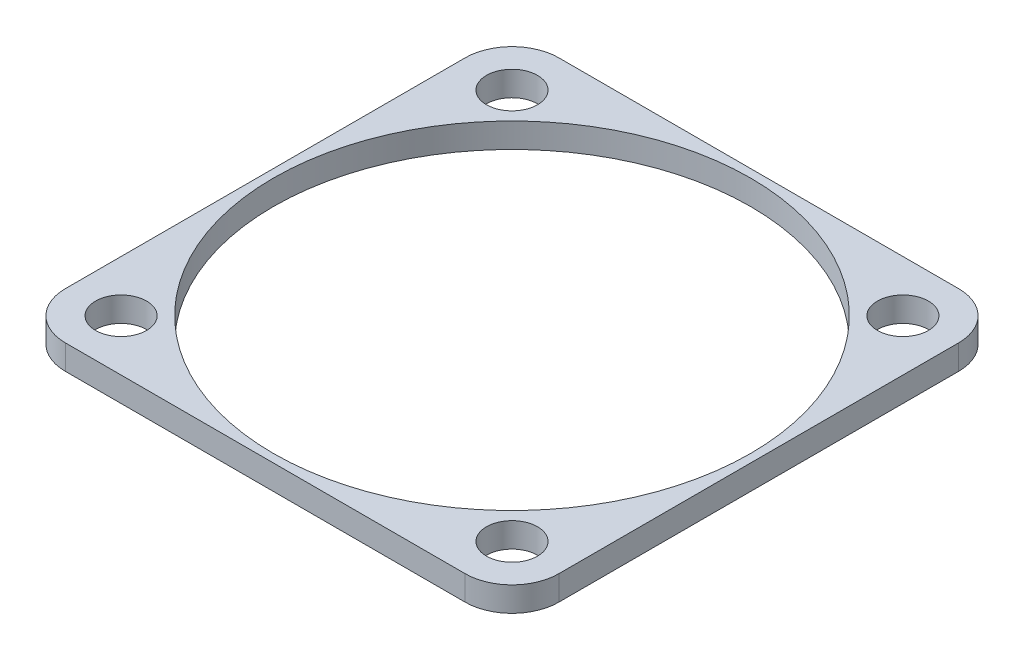
from build123d import *

# Parameters (mm, degrees)
SKETCH_1_W      = 30
SKETCH_1_H      = 30
SKETCH_1_R      = 14.5
SKETCH_1_R_2    = 1.55
EXTRUDE_1_DEPTH = 1.5
FILLET_1_R      = 2.85


with BuildPart() as part:
    # 草图1 → 凸台-拉伸1 (new body)
    with BuildSketch(Plane(origin=(0, 0, 0), x_dir=(1, 0, 0), z_dir=(0, 1, 0))):
        Rectangle(SKETCH_1_W, SKETCH_1_H)
        with Locations(Location((0, 0, 0), (0, 0, 270))):
            Circle(SKETCH_1_R, mode=Mode.SUBTRACT)
        with Locations(Location((-11.879393924, 11.879393924, 0), (0, 0, 270))):
            Circle(SKETCH_1_R_2, mode=Mode.SUBTRACT)
        with Locations(Location((11.879393924, 11.879393924, 0), (0, 0, 270))):
            Circle(SKETCH_1_R_2, mode=Mode.SUBTRACT)
        with Locations(Location((11.879393924, -11.879393924, 0), (0, 0, 270))):
            Circle(SKETCH_1_R_2, mode=Mode.SUBTRACT)
        with Locations(Location((-11.879393924, -11.879393924, 0), (0, 0, 270))):
            Circle(SKETCH_1_R_2, mode=Mode.SUBTRACT)
    extrude(amount=EXTRUDE_1_DEPTH)

    # 圆角1
    fillet_1_edges = [part.edges().sort_by_distance(p)[0] for p in [
        (-15, 0.75, 15),
        (-15, 0.75, -15),
        (15, 0.75, -15),
        (15, 0.75, 15),
    ]]
    fillet(fillet_1_edges, radius=FILLET_1_R)


solid = part.part
